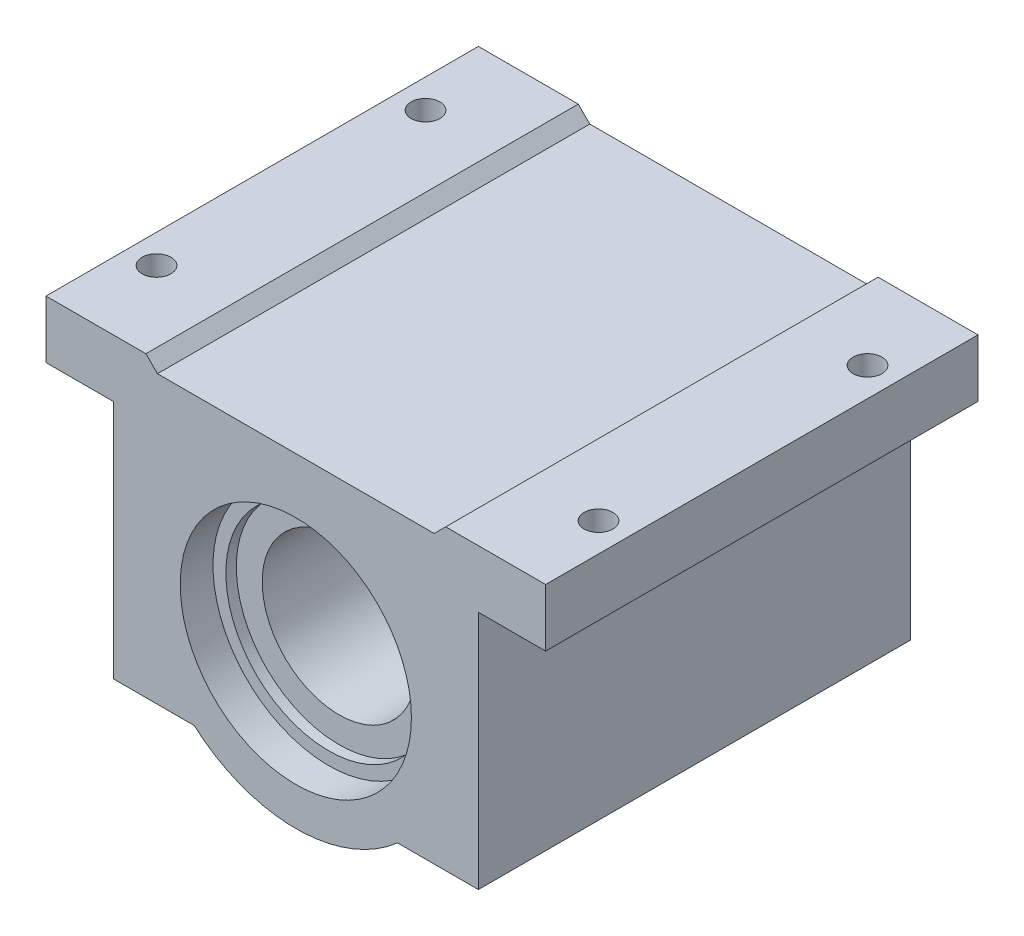
from build123d import *

# Parameters (mm, degrees)
SKETCH1_R            = 19.09953
MAIN_BODY_DEPTH      = 35.71875
SKETCH3_R            = 2.38125
MOUNTING_HOLES_DEPTH = 9.525
SKETCH8_R            = 19.09953
SKETCH8_R_2          = 12.7
INTERIOR_DEPTH       = 28.575
GROOVES_2_W          = 1.7272
GROOVES_2_H          = 4.24434
GROOVES_2_2_W        = 1.7272
GROOVES_2_2_H        = 4.24434


with BuildPart() as part:
    # Sketch1 → Main Body (new, symmetric)
    with BuildSketch(Plane.XY):
        with BuildLine():
            Line((-30.1625, 20.6375), (-41.275, 20.6375))
            Line((-41.275, 20.6375), (-41.275, 30.1625))
            Line((-41.275, 30.1625), (-24.765, 30.1625))
            Line((-24.765, 30.1625), (-22.86, 28.2575))
            Line((-22.86, 28.2575), (22.86, 28.2575))
            Line((22.86, 28.2575), (24.765, 30.1625))
            Line((24.765, 30.1625), (41.275, 30.1625))
            Line((41.275, 30.1625), (41.275, 20.6375))
            Line((41.275, 20.6375), (30.1625, 20.6375))
            Line((30.1625, 20.6375), (30.1625, -19.05))
            Line((30.1625, -19.05), (16.800520825, -19.05))
            ThreePointArc((16.800520825, -19.05), (0, -25.4), (-16.800520825, -19.05))
            Line((-16.800520825, -19.05), (-30.1625, -19.05))
            Line((-30.1625, -19.05), (-30.1625, 20.6375))
        make_face()
        Circle(SKETCH1_R, mode=Mode.SUBTRACT)
    extrude(amount=MAIN_BODY_DEPTH, both=True)

    # Sketch3 → Mounting Holes (cut)
    with BuildSketch(Plane(origin=(0, 30.1625, 0), x_dir=(1, 0, 0), z_dir=(0, 1, 0))):
        with Locations(Location((-36.5125, 22.225, 0), (0, 0, 270))):
            Circle(SKETCH3_R)
        with Locations(Location((36.5125, 22.225, 0), (0, 0, 270))):
            Circle(SKETCH3_R)
        with Locations(Location((36.5125, -22.225, 0), (0, 0, 270))):
            Circle(SKETCH3_R)
        with Locations(Location((-36.5125, -22.225, 0), (0, 0, 270))):
            Circle(SKETCH3_R)
    extrude(amount=-MOUNTING_HOLES_DEPTH, mode=Mode.SUBTRACT)

    # Grooves 2 → Grooves (revolve, cut)
    with BuildSketch(Plane(origin=(0, 0, 0), x_dir=(0, 0, -1), z_dir=(1, 0, 0)), mode=Mode.PRIVATE) as grooves_sk:
        with Locations((29.4386, -19.09953)):
            Rectangle(GROOVES_2_W, GROOVES_2_H)
        with Locations((-29.4386, -19.09953)):
            Rectangle(GROOVES_2_W, GROOVES_2_H)
    revolve(grooves_sk.sketch.rotate(Axis((0, 0, 28.575), (0, 0, -1)), 270), axis=Axis((0, 0, 28.575), (0, 0, -1)), mode=Mode.SUBTRACT)


with BuildPart() as body_2:
    # Sketch8 → Interior (new, symmetric)
    with BuildSketch(Plane.XY):
        Circle(SKETCH8_R)
        Circle(SKETCH8_R_2, mode=Mode.SUBTRACT)
    extrude(amount=INTERIOR_DEPTH, both=True)


with BuildPart() as body_3:
    # Grooves_2 2 → Retaining Ring (revolve)
    with BuildSketch(Plane(origin=(0, 0, 0), x_dir=(0, 0, -1), z_dir=(1, 0, 0)), mode=Mode.PRIVATE) as retaining_ring_sk:
        with Locations((29.4386, -19.09953)):
            Rectangle(GROOVES_2_2_W, GROOVES_2_2_H)
        with Locations((-29.4386, -19.09953)):
            Rectangle(GROOVES_2_2_W, GROOVES_2_2_H)
    revolve(retaining_ring_sk.sketch.rotate(Axis((0, 0, 28.575), (0, 0, -1)), 270), axis=Axis((0, 0, 28.575), (0, 0, -1)))


solid = Compound([part.part, body_2.part, body_3.part])
